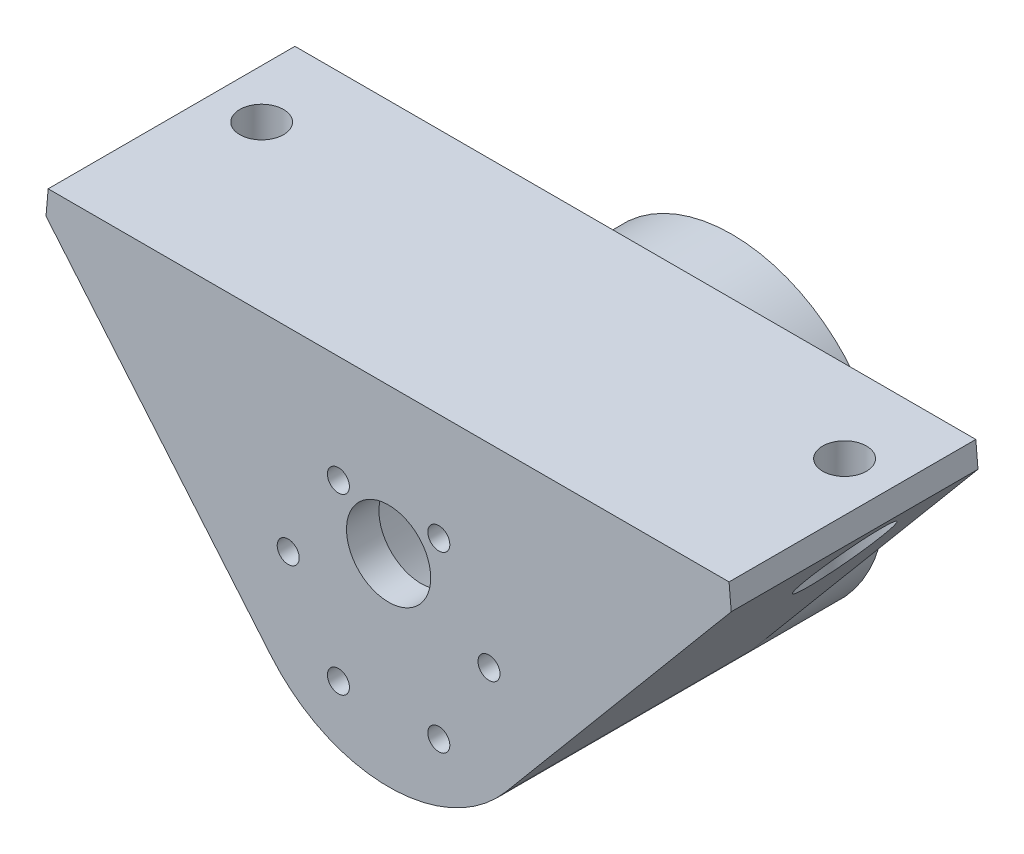
from build123d import *
from OCP.BRepFilletAPI import BRepFilletAPI_MakeChamfer

# Parameters (mm, degrees)
SKETCH1_R               = 23.7
SKETCH1_R_2             = 18.7
BOSS_EXTRUDE1_DEPTH     = 48
BOSS_EXTRUDE2_START     = 5
SKETCH1_3_R             = 23.7
SKETCH1_3_R_2           = 6.5
BOSS_EXTRUDE2_DEPTH     = 5
M3_CLEARANCE_HOLE1_D    = 3.4
CIRPATTERN1_COUNT       = 6
BOSS_EXTRUDE3_DEPTH     = 38.1
F_1_4_CLEARANCE_HOLE1_D = 6.7564
SKETCH9_R               = 5.715
CUT_EXTRUDE1_DEPTH      = 89.454226705
CHAMFER1_SIZE           = 5
CHAMFER1_SIZE2          = 3.549039071


with BuildPart() as part:
    # Sketch1 → Boss-Extrude1 (new body)
    with BuildSketch(Plane.XY):
        Circle(SKETCH1_R)
        Circle(SKETCH1_R_2, mode=Mode.SUBTRACT)
    extrude(amount=-BOSS_EXTRUDE1_DEPTH)

    # Sketch1<3> → Boss-Extrude2 (add)
    with BuildSketch(Plane.XY.offset(BOSS_EXTRUDE2_START)):
        Circle(SKETCH1_3_R)
        with Locations((0, 7.5)):
            Circle(SKETCH1_3_R_2, mode=Mode.SUBTRACT)
    extrude(amount=-BOSS_EXTRUDE2_DEPTH)

    # M3 Clearance Hole1 (through all)
    with Locations(Plane.XY.offset(5)):
        with Locations((-15.5, 0)):
            m3_clearance_hole1 = Hole(M3_CLEARANCE_HOLE1_D / 2)

    # CirPattern1: M3 Clearance Hole1 ×6 about axis
    cirpattern1_axis = Axis((0, 0, -48), (0, 0, 1))
    for i in range(1, CIRPATTERN1_COUNT):
        add(m3_clearance_hole1.rotate(cirpattern1_axis, i * 360 / CIRPATTERN1_COUNT), mode=Mode.SUBTRACT)

    # Sketch5 → Boss-Extrude3 (add)
    with BuildSketch(Plane.XY.offset(5)):
        with BuildLine():
            Line((56.111141692, 30), (-56.111141692, 30))
            Line((-56.111141692, 30), (-18.155253302, -15.23406635))
            ThreePointArc((-18.155253302, -15.23406635), (-8.105877397, 22.270715113), (23.7, 0))
            ThreePointArc((23.7, 0), (22.270715113, -8.105877397), (18.155253302, -15.23406635))
            Line((18.155253302, -15.23406635), (56.111141692, 30))
        make_face()
    extrude(amount=-BOSS_EXTRUDE3_DEPTH)

    # 1/4 Clearance Hole1 (through all)
    with Locations(Plane(origin=(0, 30, 0), x_dir=(1, 0, 0), z_dir=(0, 1, 0))):
        with Locations((-45, 20.4), (45, 20.4)):
            Hole(F_1_4_CLEARANCE_HOLE1_D / 2)

    # Sketch9 → Cut-Extrude1 (cut, through all)
    with BuildSketch(Plane(origin=(0, 25, 0), x_dir=(1, 0, 0), z_dir=(0, 1, 0))):
        with Locations((-45, 20.4)):
            Circle(SKETCH9_R)
        with Locations((45, 20.4)):
            Circle(SKETCH9_R)
    extrude(amount=-CUT_EXTRUDE1_DEPTH, mode=Mode.SUBTRACT)

    # Chamfer1: one chamfer whose edges measure the first distance from different faces: ONE call of the kernel's chamfer builder (chamfer() names one face for all edges)
    chamfer1_edges_1 = [part.edges().sort_by_distance(p)[0] for p in [
        (56.111141692, 30, -14.05),
    ]]
    chamfer1_side_1 = [part.faces().sort_by_distance(p)[0] for p in [
        (36.532384477, 6.666945749, -13.565030067),
    ]]
    chamfer1_edges_2 = [part.edges().sort_by_distance(p)[0] for p in [
        (-56.111141692, 30, -14.05),
    ]]
    chamfer1_side_2 = [part.faces().sort_by_distance(p)[0] for p in [
        (-36.532384477, 6.666945749, -13.565030067),
    ]]
    chamfer1 = BRepFilletAPI_MakeChamfer(part.part.solid().wrapped)
    for e in chamfer1_edges_1:
        chamfer1.Add(CHAMFER1_SIZE, CHAMFER1_SIZE2, e.wrapped, chamfer1_side_1[0].wrapped)  # the first distance lies on this face
    for e in chamfer1_edges_2:
        chamfer1.Add(CHAMFER1_SIZE, CHAMFER1_SIZE2, e.wrapped, chamfer1_side_2[0].wrapped)  # the first distance lies on this face
    add(Compound.cast(chamfer1.Shape()), mode=Mode.REPLACE)


solid = part.part
